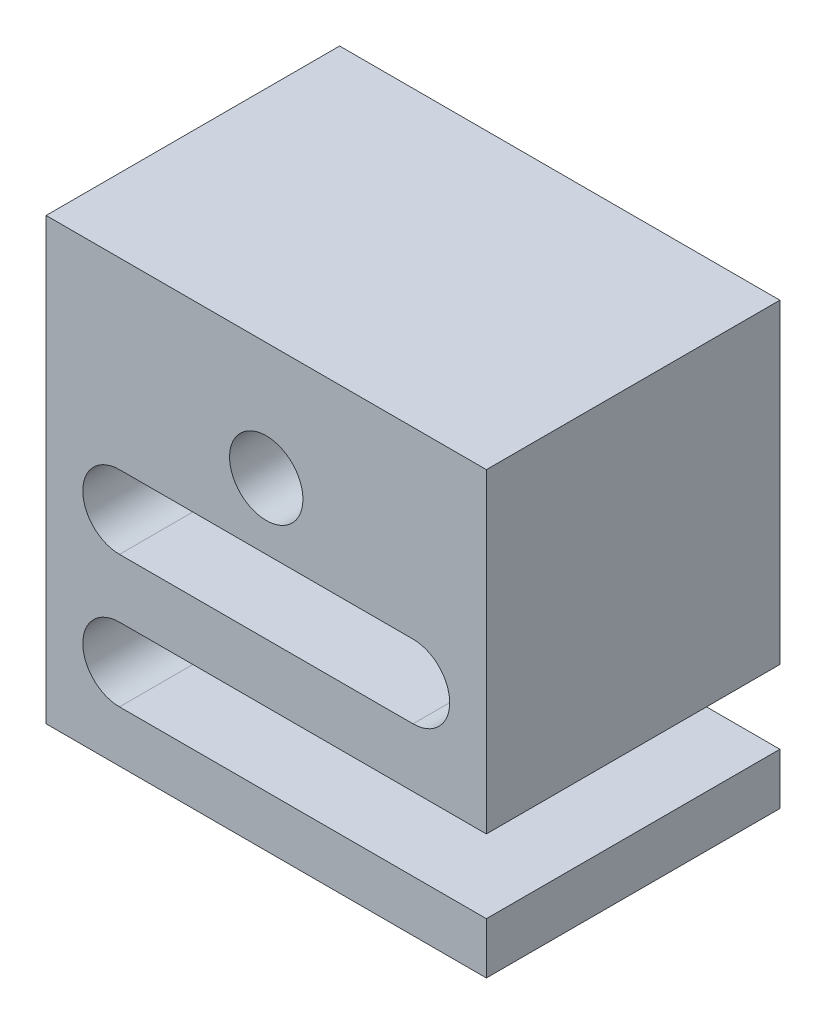
from build123d import *

# Parameters (mm, degrees)
SKETCH1_W                   = 38.1
SKETCH1_H                   = 38.1
BOSS_EXTRUDE1_DEPTH         = 12.7
CUT_EXTRUDE1_DEPTH          = 25.4
F_1_4_0_25_DIAMETER_HOLE1_D = 6.35
CUT_EXTRUDE2_DEPTH          = 25.4


with BuildPart() as part:
    # Sketch1 → Boss-Extrude1 (new, symmetric)
    with BuildSketch(Plane.XY):
        Rectangle(SKETCH1_W, SKETCH1_H)
    extrude(amount=BOSS_EXTRUDE1_DEPTH, both=True)

    # Sketch2 → Cut-Extrude1 (cut)
    with BuildSketch(Plane.XY.offset(12.7)):
        with BuildLine():
            Line((-12.7, -8.255), (19.05, -8.255))
            ThreePointArc((19.05, -8.255), (22.225, -11.43), (19.05, -14.605))
            Line((19.05, -14.605), (-12.7, -14.605))
            ThreePointArc((-12.7, -14.605), (-15.875, -11.43), (-12.7, -8.255))
        make_face()
    extrude(amount=-CUT_EXTRUDE1_DEPTH, mode=Mode.SUBTRACT)

    # 1/4 (0.25) Diameter Hole1 (through all)
    with Locations(Plane.XY.offset(12.7)):
        with Locations((0, 8.89)):
            Hole(F_1_4_0_25_DIAMETER_HOLE1_D / 2)

    # Sketch7 → Cut-Extrude2 (cut)
    with BuildSketch(Plane.XY.offset(12.7)):
        with BuildLine():
            Line((-12.7, 3.175), (12.7, 3.175))
            ThreePointArc((12.7, 3.175), (15.875, 0), (12.7, -3.175))
            Line((12.7, -3.175), (-12.7, -3.175))
            ThreePointArc((-12.7, -3.175), (-15.875, 0), (-12.7, 3.175))
        make_face()
    extrude(amount=-CUT_EXTRUDE2_DEPTH, mode=Mode.SUBTRACT)


solid = part.part
